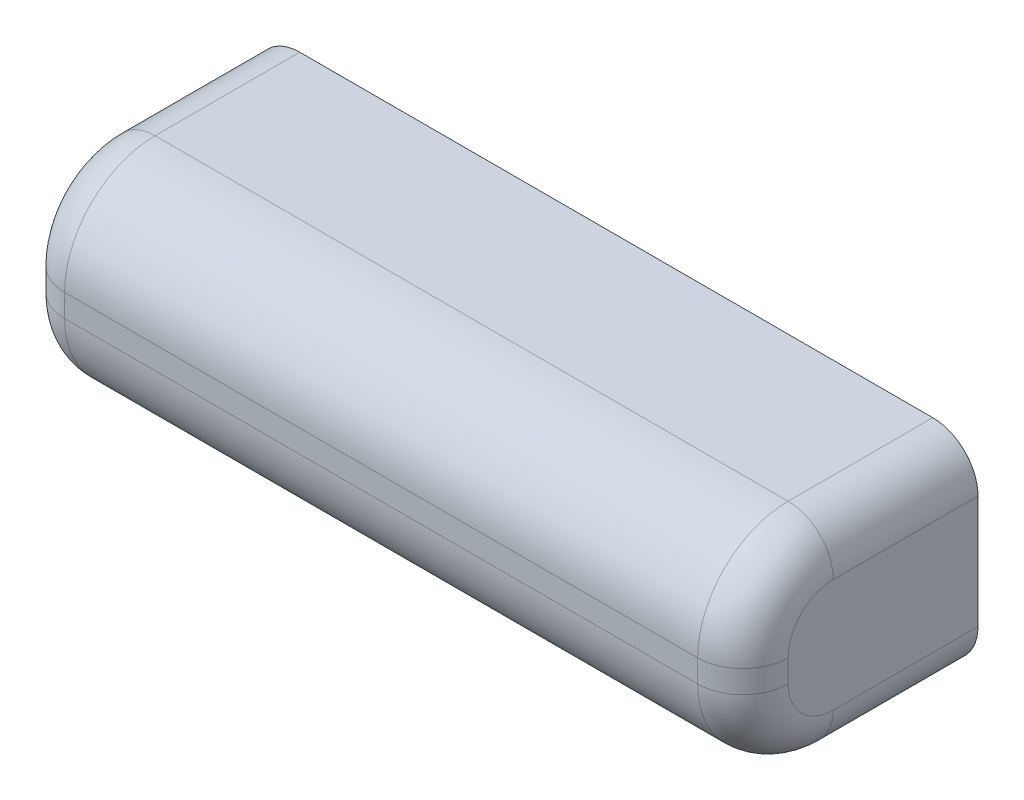
from build123d import *

# Parameters (mm, degrees)
SKETCH_1_W             = 160
SKETCH_1_H             = 45
EXTRUDE_1_DEPTH        = 52
SKETCH_2_R             = 15
CUT_EXTRUDE_1_DEPTH    = 10
PATTERN_LINEAR_2_COUNT = 3
PATTERN_LINEAR_2_PITCH = 32
PATTERN_LINEAR_3_COUNT = 3
PATTERN_LINEAR_3_PITCH = 32
FILLET_1_R             = 20
FILLET_2_R             = 10


with BuildPart() as part:
    # 스케치1 → 보스-돌출1 (new body)
    with BuildSketch(Plane.XY):
        Rectangle(SKETCH_1_W, SKETCH_1_H)
    extrude(amount=EXTRUDE_1_DEPTH)

    # 스케치2 → 컷-돌출1 (cut)
    with BuildSketch(Plane(origin=(0, 0, 0), x_dir=(-1, 0, 0), z_dir=(0, 0, -1))):
        Circle(SKETCH_2_R)
    cut_extrude_1 = extrude(amount=-CUT_EXTRUDE_1_DEPTH, mode=Mode.SUBTRACT)

    # 선형 패턴2: 컷-돌출1 ×3
    with Locations(*[(-i * PATTERN_LINEAR_2_PITCH, 0, 0) for i in range(1, PATTERN_LINEAR_2_COUNT)]):
        add(cut_extrude_1, mode=Mode.SUBTRACT)

    # 선형 패턴3: 컷-돌출1 ×3
    with Locations(*[(i * PATTERN_LINEAR_3_PITCH, 0, 0) for i in range(1, PATTERN_LINEAR_3_COUNT)]):
        add(cut_extrude_1, mode=Mode.SUBTRACT)

    # 필렛1
    fillet_1_edges = [part.edges().sort_by_distance(p)[0] for p in [
        (0, -22.5, 52),
        (0, 22.5, 52),
    ]]
    fillet(fillet_1_edges, radius=FILLET_1_R)

    # 필렛2
    fillet_2_edges = [part.edges().sort_by_distance(p)[0] for p in [
        (80, 0, 52),
        (-80, 0, 52),
        (80, 22.5, 16),
        (80, -22.5, 16),
        (80, 16.642135624, 46.142135624),
        (80, -16.642135624, 46.142135624),
        (-80, -22.5, 16),
        (-80, 22.5, 16),
        (-80, 16.642135624, 46.142135624),
        (-80, -16.642135624, 46.142135624),
    ]]
    fillet(fillet_2_edges, radius=FILLET_2_R)


solid = part.part
